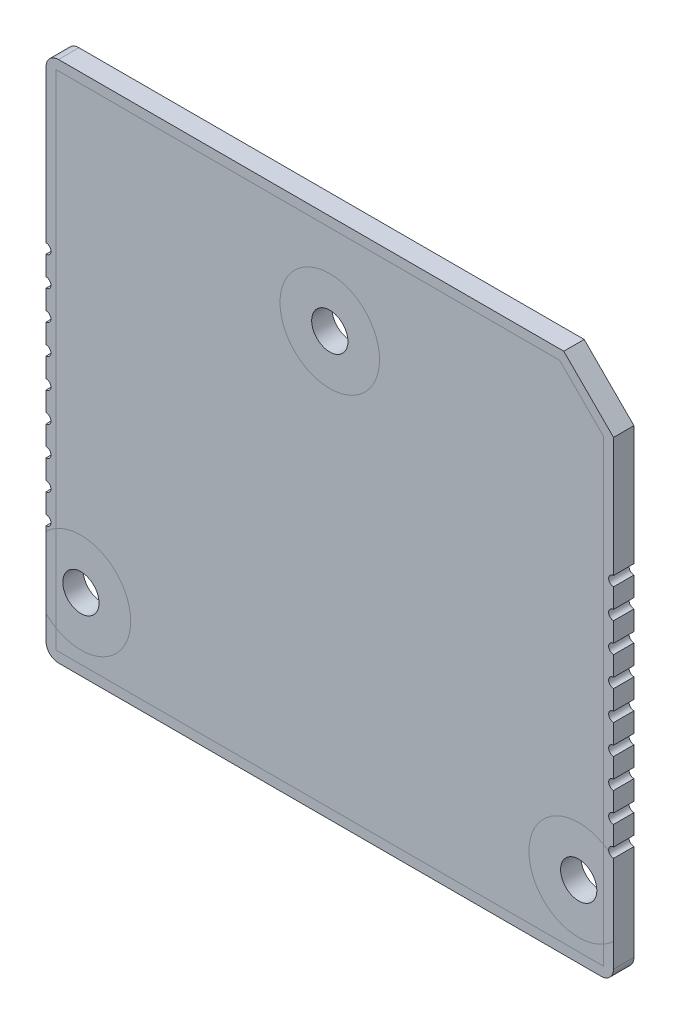
from build123d import *

# Parameters (mm, degrees)
BOSS_EXTRUDE1_DEPTH = 1.041
CUT_EXTRUDE1_REACH  = 41.38
SKETCH2_R           = 0.925
SKETCH2_R_2         = 0.25
SKETCH2_R_3         = 0.92499942


with BuildPart() as part:
    # Sketch1 → Boss-Extrude1 (new body)
    with BuildSketch(Plane(origin=(0, 0, 0), x_dir=(1, 0, 0), z_dir=(0, 0, -1))):
        with BuildLine():
            Line((26.416, -26.67), (28.956, -24.13))
            Line((28.956, -24.13), (28.956, -0.635))
            ThreePointArc((28.956, -0.635), (28.770012806, -0.185987194), (28.321, 0))
            Line((28.321, 0), (0.635, 0))
            ThreePointArc((0.635, 0), (0.185987194, -0.185987194), (0, -0.635))
            Line((0, -0.635), (0, -26.035))
            ThreePointArc((0, -26.035), (0.185987194, -26.484012806), (0.635, -26.67))
            Line((0.635, -26.67), (26.416, -26.67))
        make_face()
    extrude(amount=BOSS_EXTRUDE1_DEPTH)

    # Sketch2 → Cut-Extrude1 (cut, up to next)
    with BuildSketch(Plane.XY, mode=Mode.PRIVATE) as cut_extrude1_sk1:
        with Locations((1.778, 3.683)):
            Circle(SKETCH2_R)
    cut_extrude1_tool1 = extrude(cut_extrude1_sk1.sketch, amount=-CUT_EXTRUDE1_REACH, mode=Mode.PRIVATE) & part.part
    # Sketch2 → Cut-Extrude1 (cut, up to next)
    with BuildSketch(Plane.XY, mode=Mode.PRIVATE) as cut_extrude1_sk2:
        with Locations((27.178, 3.683)):
            Circle(SKETCH2_R)
    cut_extrude1_tool2 = extrude(cut_extrude1_sk2.sketch, amount=-CUT_EXTRUDE1_REACH, mode=Mode.PRIVATE) & part.part
    # Sketch2 → Cut-Extrude1 (cut, up to next)
    with BuildSketch(Plane.XY, mode=Mode.PRIVATE) as cut_extrude1_sk3:
        with Locations((0, 6)):
            Circle(SKETCH2_R_2)
    cut_extrude1_tool3 = extrude(cut_extrude1_sk3.sketch, amount=-CUT_EXTRUDE1_REACH, mode=Mode.PRIVATE) & part.part
    # Sketch2 → Cut-Extrude1 (cut, up to next)
    with BuildSketch(Plane.XY, mode=Mode.PRIVATE) as cut_extrude1_sk4:
        with Locations((28.956, 5.78000114)):
            Circle(SKETCH2_R_2)
    cut_extrude1_tool4 = extrude(cut_extrude1_sk4.sketch, amount=-CUT_EXTRUDE1_REACH, mode=Mode.PRIVATE) & part.part
    # Sketch2 → Cut-Extrude1 (cut, up to next)
    with BuildSketch(Plane.XY, mode=Mode.PRIVATE) as cut_extrude1_sk5:
        with Locations((28.956, 7.28000114)):
            Circle(SKETCH2_R_2)
    cut_extrude1_tool5 = extrude(cut_extrude1_sk5.sketch, amount=-CUT_EXTRUDE1_REACH, mode=Mode.PRIVATE) & part.part
    # Sketch2 → Cut-Extrude1 (cut, up to next)
    with BuildSketch(Plane.XY, mode=Mode.PRIVATE) as cut_extrude1_sk6:
        with Locations((28.956, 8.78000114)):
            Circle(SKETCH2_R_2)
    cut_extrude1_tool6 = extrude(cut_extrude1_sk6.sketch, amount=-CUT_EXTRUDE1_REACH, mode=Mode.PRIVATE) & part.part
    # Sketch2 → Cut-Extrude1 (cut, up to next)
    with BuildSketch(Plane.XY, mode=Mode.PRIVATE) as cut_extrude1_sk7:
        with Locations((28.956, 10.28000114)):
            Circle(SKETCH2_R_2)
    cut_extrude1_tool7 = extrude(cut_extrude1_sk7.sketch, amount=-CUT_EXTRUDE1_REACH, mode=Mode.PRIVATE) & part.part
    # Sketch2 → Cut-Extrude1 (cut, up to next)
    with BuildSketch(Plane.XY, mode=Mode.PRIVATE) as cut_extrude1_sk8:
        with Locations((28.956, 11.78000114)):
            Circle(SKETCH2_R_2)
    cut_extrude1_tool8 = extrude(cut_extrude1_sk8.sketch, amount=-CUT_EXTRUDE1_REACH, mode=Mode.PRIVATE) & part.part
    # Sketch2 → Cut-Extrude1 (cut, up to next)
    with BuildSketch(Plane.XY, mode=Mode.PRIVATE) as cut_extrude1_sk9:
        with Locations((28.956, 13.28000114)):
            Circle(SKETCH2_R_2)
    cut_extrude1_tool9 = extrude(cut_extrude1_sk9.sketch, amount=-CUT_EXTRUDE1_REACH, mode=Mode.PRIVATE) & part.part
    # Sketch2 → Cut-Extrude1 (cut, up to next)
    with BuildSketch(Plane.XY, mode=Mode.PRIVATE) as cut_extrude1_sk10:
        with Locations((28.956, 14.78000114)):
            Circle(SKETCH2_R_2)
    cut_extrude1_tool10 = extrude(cut_extrude1_sk10.sketch, amount=-CUT_EXTRUDE1_REACH, mode=Mode.PRIVATE) & part.part
    # Sketch2 → Cut-Extrude1 (cut, up to next)
    with BuildSketch(Plane.XY, mode=Mode.PRIVATE) as cut_extrude1_sk11:
        with Locations((0, 7.5)):
            Circle(SKETCH2_R_2)
    cut_extrude1_tool11 = extrude(cut_extrude1_sk11.sketch, amount=-CUT_EXTRUDE1_REACH, mode=Mode.PRIVATE) & part.part
    # Sketch2 → Cut-Extrude1 (cut, up to next)
    with BuildSketch(Plane.XY, mode=Mode.PRIVATE) as cut_extrude1_sk12:
        with Locations((0, 9)):
            Circle(SKETCH2_R_2)
    cut_extrude1_tool12 = extrude(cut_extrude1_sk12.sketch, amount=-CUT_EXTRUDE1_REACH, mode=Mode.PRIVATE) & part.part
    # Sketch2 → Cut-Extrude1 (cut, up to next)
    with BuildSketch(Plane.XY, mode=Mode.PRIVATE) as cut_extrude1_sk13:
        with Locations((0, 10.5)):
            Circle(SKETCH2_R_2)
    cut_extrude1_tool13 = extrude(cut_extrude1_sk13.sketch, amount=-CUT_EXTRUDE1_REACH, mode=Mode.PRIVATE) & part.part
    # Sketch2 → Cut-Extrude1 (cut, up to next)
    with BuildSketch(Plane.XY, mode=Mode.PRIVATE) as cut_extrude1_sk14:
        with Locations((0, 12)):
            Circle(SKETCH2_R_2)
    cut_extrude1_tool14 = extrude(cut_extrude1_sk14.sketch, amount=-CUT_EXTRUDE1_REACH, mode=Mode.PRIVATE) & part.part
    # Sketch2 → Cut-Extrude1 (cut, up to next)
    with BuildSketch(Plane.XY, mode=Mode.PRIVATE) as cut_extrude1_sk15:
        with Locations((0, 13.5)):
            Circle(SKETCH2_R_2)
    cut_extrude1_tool15 = extrude(cut_extrude1_sk15.sketch, amount=-CUT_EXTRUDE1_REACH, mode=Mode.PRIVATE) & part.part
    # Sketch2 → Cut-Extrude1 (cut, up to next)
    with BuildSketch(Plane.XY, mode=Mode.PRIVATE) as cut_extrude1_sk16:
        with Locations((0, 15)):
            Circle(SKETCH2_R_2)
    cut_extrude1_tool16 = extrude(cut_extrude1_sk16.sketch, amount=-CUT_EXTRUDE1_REACH, mode=Mode.PRIVATE) & part.part
    # Sketch2 → Cut-Extrude1 (cut, up to next)
    with BuildSketch(Plane.XY, mode=Mode.PRIVATE) as cut_extrude1_sk17:
        with Locations((0, 16.5)):
            Circle(SKETCH2_R_2)
    cut_extrude1_tool17 = extrude(cut_extrude1_sk17.sketch, amount=-CUT_EXTRUDE1_REACH, mode=Mode.PRIVATE) & part.part
    # Sketch2 → Cut-Extrude1 (cut, up to next)
    with BuildSketch(Plane.XY, mode=Mode.PRIVATE) as cut_extrude1_sk18:
        with Locations((28.956, 16.28000114)):
            Circle(SKETCH2_R_2)
    cut_extrude1_tool18 = extrude(cut_extrude1_sk18.sketch, amount=-CUT_EXTRUDE1_REACH, mode=Mode.PRIVATE) & part.part
    # Sketch2 → Cut-Extrude1 (cut, up to next)
    with BuildSketch(Plane.XY, mode=Mode.PRIVATE) as cut_extrude1_sk19:
        with Locations((0, 18)):
            Circle(SKETCH2_R_2)
    cut_extrude1_tool19 = extrude(cut_extrude1_sk19.sketch, amount=-CUT_EXTRUDE1_REACH, mode=Mode.PRIVATE) & part.part
    # Sketch2 → Cut-Extrude1 (cut, up to next)
    with BuildSketch(Plane.XY, mode=Mode.PRIVATE) as cut_extrude1_sk20:
        with Locations((28.956, 17.78000114)):
            Circle(SKETCH2_R_2)
    cut_extrude1_tool20 = extrude(cut_extrude1_sk20.sketch, amount=-CUT_EXTRUDE1_REACH, mode=Mode.PRIVATE) & part.part
    # Sketch2 → Cut-Extrude1 (cut, up to next)
    with BuildSketch(Plane.XY, mode=Mode.PRIVATE) as cut_extrude1_sk21:
        with Locations((14.478, 21.59)):
            Circle(SKETCH2_R_3)
    cut_extrude1_tool21 = extrude(cut_extrude1_sk21.sketch, amount=-CUT_EXTRUDE1_REACH, mode=Mode.PRIVATE) & part.part
    add(cut_extrude1_tool1.solids().sort_by_distance((1.778, 3.683, 0))[0], mode=Mode.SUBTRACT)
    add(cut_extrude1_tool2.solids().sort_by_distance((27.178, 3.683, 0))[0], mode=Mode.SUBTRACT)
    add(cut_extrude1_tool3.solids().sort_by_distance((0, 6, 0))[0], mode=Mode.SUBTRACT)
    add(cut_extrude1_tool4.solids().sort_by_distance((28.956, 5.780001, 0))[0], mode=Mode.SUBTRACT)
    add(cut_extrude1_tool5.solids().sort_by_distance((28.956, 7.280001, 0))[0], mode=Mode.SUBTRACT)
    add(cut_extrude1_tool6.solids().sort_by_distance((28.956, 8.780001, 0))[0], mode=Mode.SUBTRACT)
    add(cut_extrude1_tool7.solids().sort_by_distance((28.956, 10.280001, 0))[0], mode=Mode.SUBTRACT)
    add(cut_extrude1_tool8.solids().sort_by_distance((28.956, 11.780001, 0))[0], mode=Mode.SUBTRACT)
    add(cut_extrude1_tool9.solids().sort_by_distance((28.956, 13.280001, 0))[0], mode=Mode.SUBTRACT)
    add(cut_extrude1_tool10.solids().sort_by_distance((28.956, 14.780001, 0))[0], mode=Mode.SUBTRACT)
    add(cut_extrude1_tool11.solids().sort_by_distance((0, 7.5, 0))[0], mode=Mode.SUBTRACT)
    add(cut_extrude1_tool12.solids().sort_by_distance((0, 9, 0))[0], mode=Mode.SUBTRACT)
    add(cut_extrude1_tool13.solids().sort_by_distance((0, 10.5, 0))[0], mode=Mode.SUBTRACT)
    add(cut_extrude1_tool14.solids().sort_by_distance((0, 12, 0))[0], mode=Mode.SUBTRACT)
    add(cut_extrude1_tool15.solids().sort_by_distance((0, 13.5, 0))[0], mode=Mode.SUBTRACT)
    add(cut_extrude1_tool16.solids().sort_by_distance((0, 15, 0))[0], mode=Mode.SUBTRACT)
    add(cut_extrude1_tool17.solids().sort_by_distance((0, 16.5, 0))[0], mode=Mode.SUBTRACT)
    add(cut_extrude1_tool18.solids().sort_by_distance((28.956, 16.280001, 0))[0], mode=Mode.SUBTRACT)
    add(cut_extrude1_tool19.solids().sort_by_distance((0, 18, 0))[0], mode=Mode.SUBTRACT)
    add(cut_extrude1_tool20.solids().sort_by_distance((28.956, 17.780001, 0))[0], mode=Mode.SUBTRACT)
    add(cut_extrude1_tool21.solids().sort_by_distance((14.478, 21.59, 0))[0], mode=Mode.SUBTRACT)


solid = part.part
